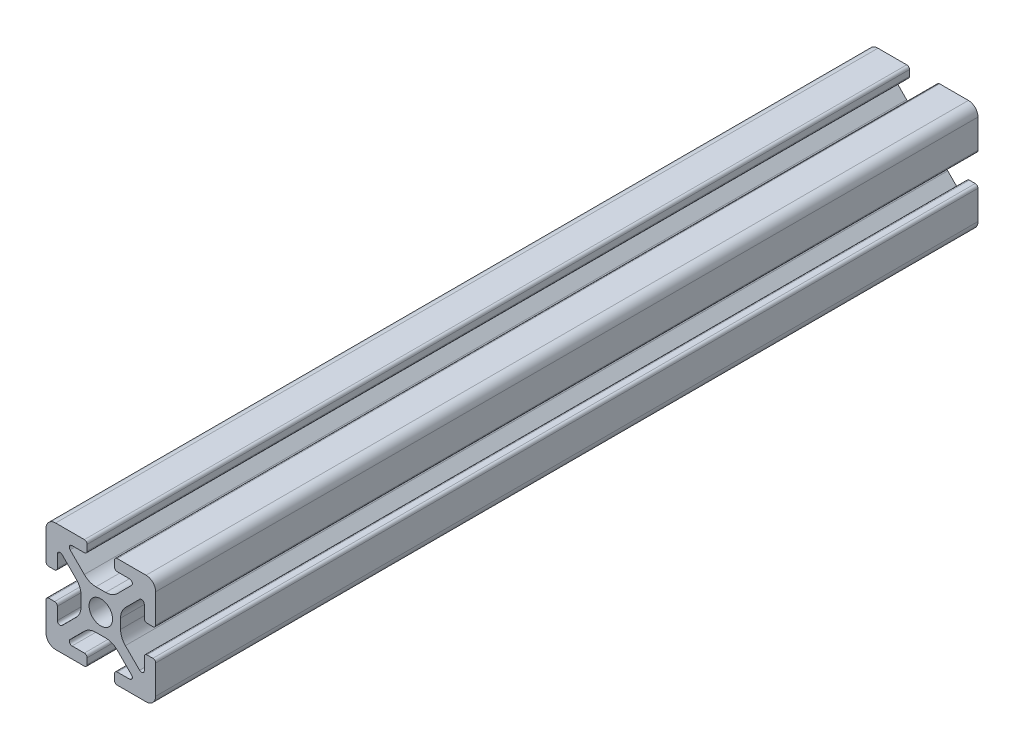
from build123d import *

# Parameters (mm, degrees)
BOSS_EXTRUDE1_DEPTH = 76.2
SKETCH5_W           = 27.787302718
SKETCH5_H           = 26.03929452
CUT_EXTRUDE1_DEPTH  = 2.4


with BuildPart() as part:
    # Sketch4 → Boss-Extrude1 (new, symmetric)
    with BuildSketch(Plane.XY):
        with BuildLine():
            Line((3, -10), (8.25, -10))
            ThreePointArc((8.25, -10), (9.487436867, -9.487436867), (10, -8.25))
            Line((10, -8.25), (10, -3))
            ThreePointArc((10, -3), (9.853553391, -2.646446609), (9.5, -2.5))
            Line((9.5, -2.5), (8.424621202, -2.5))
            ThreePointArc((8.424621202, -2.5), (8.071067812, -2.646446609), (7.924621202, -3))
            Line((7.924621202, -3), (7.924621202, -5.25))
            ThreePointArc((7.924621202, -5.25), (7.615962919, -5.711939766), (7.071067812, -5.603553391))
            Line((7.071067812, -5.603553391), (4.478679656, -3.011165235))
            ThreePointArc((4.478679656, -3.011165235), (3.828361402, -2.037895189), (3.6, -0.889844892))
            Line((3.6, -0.889844892), (3.6, 0))
            Line((3.6, 0), (2.15, 0))
            ThreePointArc((2.15, 0), (1.52027958, -1.52027958), (0, -2.15))
            Line((0, -2.15), (0, -3.6))
            Line((0, -3.6), (0.889844892, -3.6))
            ThreePointArc((0.889844892, -3.6), (2.037895189, -3.828361402), (3.011165235, -4.478679656))
            Line((3.011165235, -4.478679656), (5.603553391, -7.071067812))
            ThreePointArc((5.603553391, -7.071067812), (5.711939766, -7.615962919), (5.25, -7.924621202))
            Line((5.25, -7.924621202), (3, -7.924621202))
            ThreePointArc((3, -7.924621202), (2.646446609, -8.071067812), (2.5, -8.424621202))
            Line((2.5, -8.424621202), (2.5, -9.5))
            ThreePointArc((2.5, -9.5), (2.646446609, -9.853553391), (3, -10))
        make_face()
    extrude(amount=BOSS_EXTRUDE1_DEPTH, both=True)

    # Mirror1: part across plane


with BuildPart() as part_1:
    add(part.part)
    add(part.part.mirror(Plane(origin=(0, 0, 0), x_dir=(0, 0, 1), z_dir=(1, 0, 0))))

    # Mirror2: part across plane


with BuildPart() as part_2:
    add(part_1.part)
    add(part_1.part.mirror(Plane.ZX))

    # Sketch5 → Cut-Extrude1 (cut)
    with BuildSketch(Plane.XY.offset(76.2)):
        with Locations((-0.060276145, -0.663037592)):
            Rectangle(SKETCH5_W, SKETCH5_H)
    extrude(amount=-CUT_EXTRUDE1_DEPTH, mode=Mode.SUBTRACT)


solid = part_2.part
